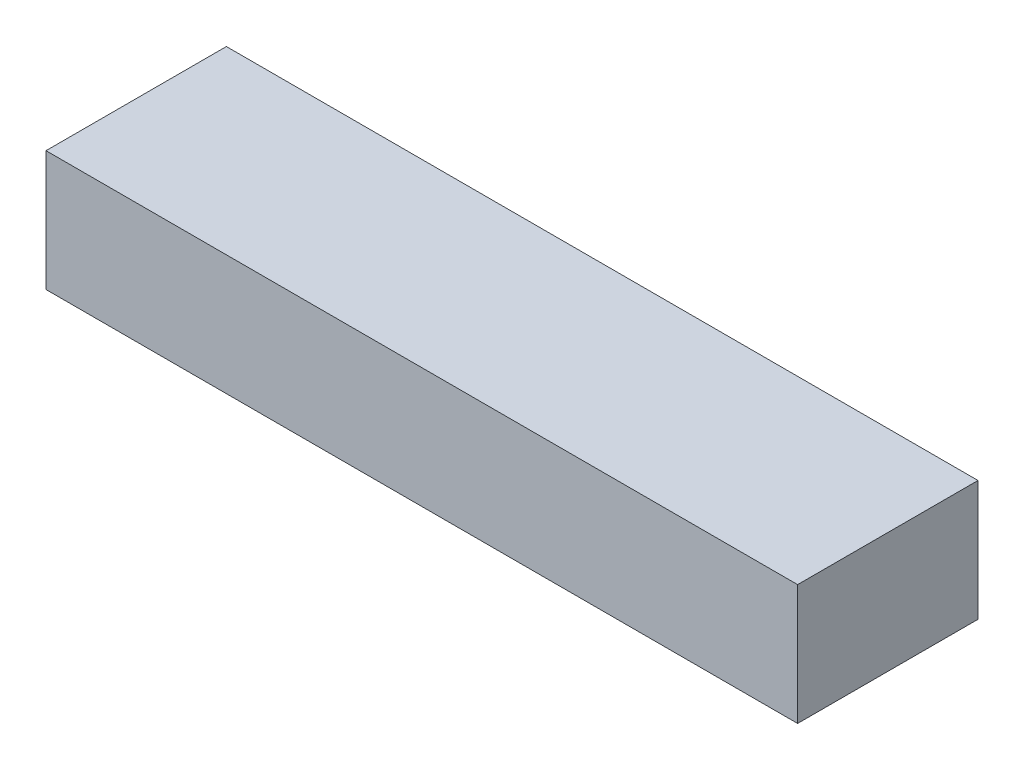
from build123d import *

# Parameters (mm, degrees)
SKETCH1_W           = 50
SKETCH1_H           = 12
BOSS_EXTRUDE1_DEPTH = 8


with BuildPart() as part:
    # Sketch1 → Boss-Extrude1 (new body)
    with BuildSketch(Plane(origin=(0, 0, 0), x_dir=(1, 0, 0), z_dir=(0, 1, 0))):
        Rectangle(SKETCH1_W, SKETCH1_H)
    extrude(amount=BOSS_EXTRUDE1_DEPTH)


solid = part.part
